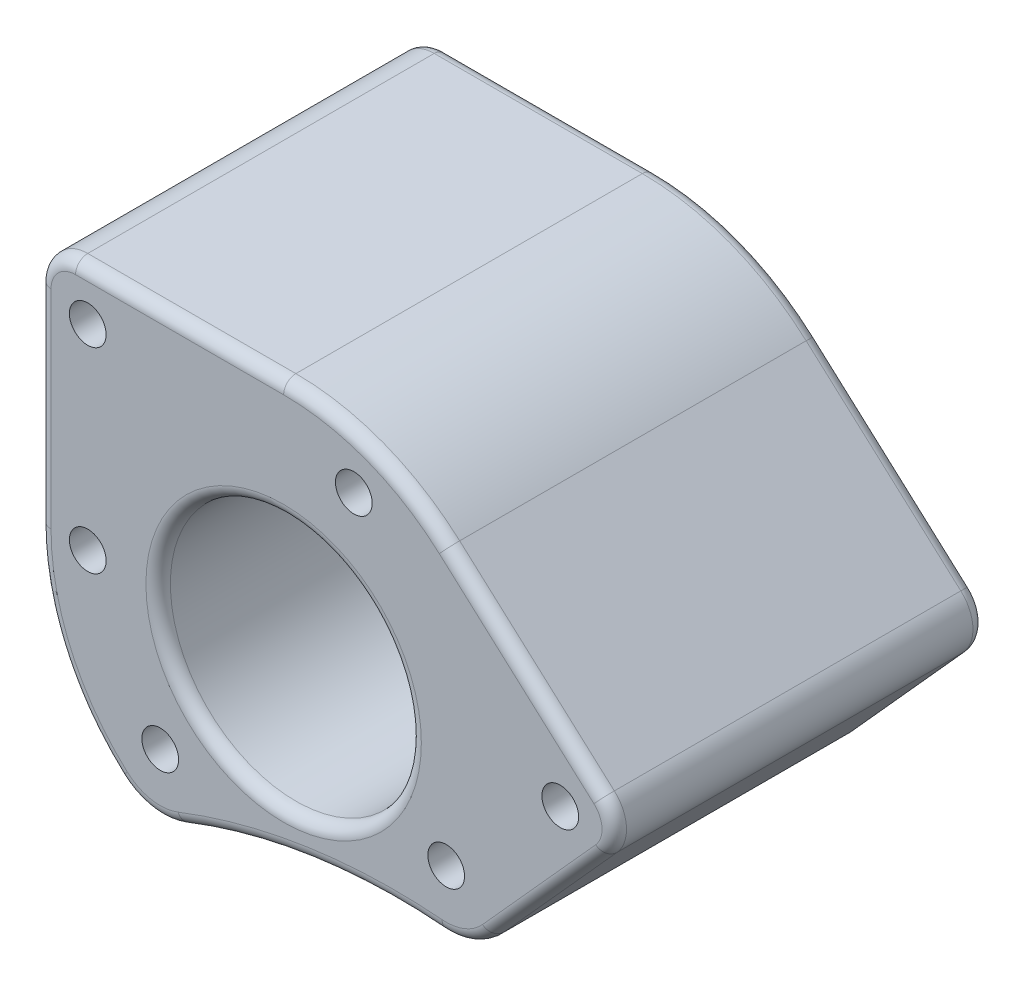
from build123d import *

# Parameters (mm, degrees)
SKETCH_1_R               = 10.25
EXTRUDE_1_DEPTH          = 30.3
CUT_EXTRUDE_1_DEPTH      = 268.033508634
CUT_EXTRUDE_1_DEPTH_BACK = 268.033508634
SKETCH_2_R               = 1.5
FILLET_1_R               = 1


with BuildPart() as part:
    # 草图1 → 凸台-拉伸1 (new body)
    with BuildSketch(Plane.XY):
        with BuildLine():
            Line((205.951402916, 77), (205.951402916, 60))
            ThreePointArc((205.951402916, 60), (207.664953018, 51.900262342), (212.511977929, 45.188455313))
            ThreePointArc((212.511977929, 45.188455313), (214.967004798, 43.973894607), (217.693564254, 44.235023248))
            ThreePointArc((217.693564254, 44.235023248), (228.082885446, 46.993654106), (238.826448864, 47.345625871))
            ThreePointArc((238.826448864, 47.345625871), (241.077132686, 47.68338128), (242.944957082, 48.983722931))
            Line((242.944957082, 48.983722931), (252.189519734, 59.250849906))
            ThreePointArc((252.189519734, 59.250849906), (252.955973862, 61.415249594), (251.967477077, 63.487676201))
            Line((251.967477077, 63.487676201), (239.334015044, 74.86289651))
            ThreePointArc((239.334015044, 74.86289651), (233.118761907, 78.67160853), (225.951402916, 80))
            Line((225.951402916, 80), (208.951402916, 80))
            ThreePointArc((208.951402916, 80), (206.830082573, 79.121320344), (205.951402916, 77))
        make_face()
        with Locations((225.951402916, 60)):
            Circle(SKETCH_1_R, mode=Mode.SUBTRACT)
    extrude(amount=EXTRUDE_1_DEPTH)

    # 草图2 → 切除-拉伸1 (cut, two sides: drawn at the far end of the back side and taken through both)
    with BuildSketch(Plane.XY.offset(30.3).offset(-CUT_EXTRUDE_1_DEPTH_BACK)):
        with Locations((215.871834176, 48.891341485)):
            Circle(SKETCH_2_R)
        with Locations((209.951402916, 60)):
            Circle(SKETCH_2_R)
        with Locations((209.951402916, 76)):
            Circle(SKETCH_2_R)
        with Locations((231.685290109, 74.937286824)):
            Circle(SKETCH_2_R)
        with Locations((239.229232955, 52.329375962)):
            Circle(SKETCH_2_R)
        with Locations((248.547809826, 61.184227506)):
            Circle(SKETCH_2_R)
    extrude(amount=CUT_EXTRUDE_1_DEPTH + CUT_EXTRUDE_1_DEPTH_BACK, mode=Mode.SUBTRACT)

    # 圆角1
    fillet_1_edges = [part.edges().sort_by_distance(p)[0] for p in [
        (205.951402916, 68.5, 0),
        (205.951402916, 68.5, 30.3),
        (206.830082573, 79.121320344, 0),
        (206.830082573, 79.121320344, 30.3),
        (207.664953018, 51.900262342, 0),
        (207.664953018, 51.900262342, 30.3),
        (217.451402916, 80, 0),
        (214.967004798, 43.973894607, 0),
        (233.118761907, 78.67160853, 0),
        (228.082885446, 46.993654106, 0),
        (245.65074606, 69.175286355, 0),
        (241.077132686, 47.68338128, 0),
        (252.955973862, 61.415249594, 0),
        (247.567238408, 54.117286418, 0),
        (215.701402916, 60, 0),
        (217.451402916, 80, 30.3),
        (214.967004798, 43.973894607, 30.3),
        (233.118761907, 78.67160853, 30.3),
        (228.082885446, 46.993654106, 30.3),
        (245.65074606, 69.175286355, 30.3),
        (241.077132686, 47.68338128, 30.3),
        (252.955973862, 61.415249594, 30.3),
        (247.567238408, 54.117286418, 30.3),
        (215.701402916, 60, 30.3),
    ]]
    fillet(fillet_1_edges, radius=FILLET_1_R)


solid = part.part
